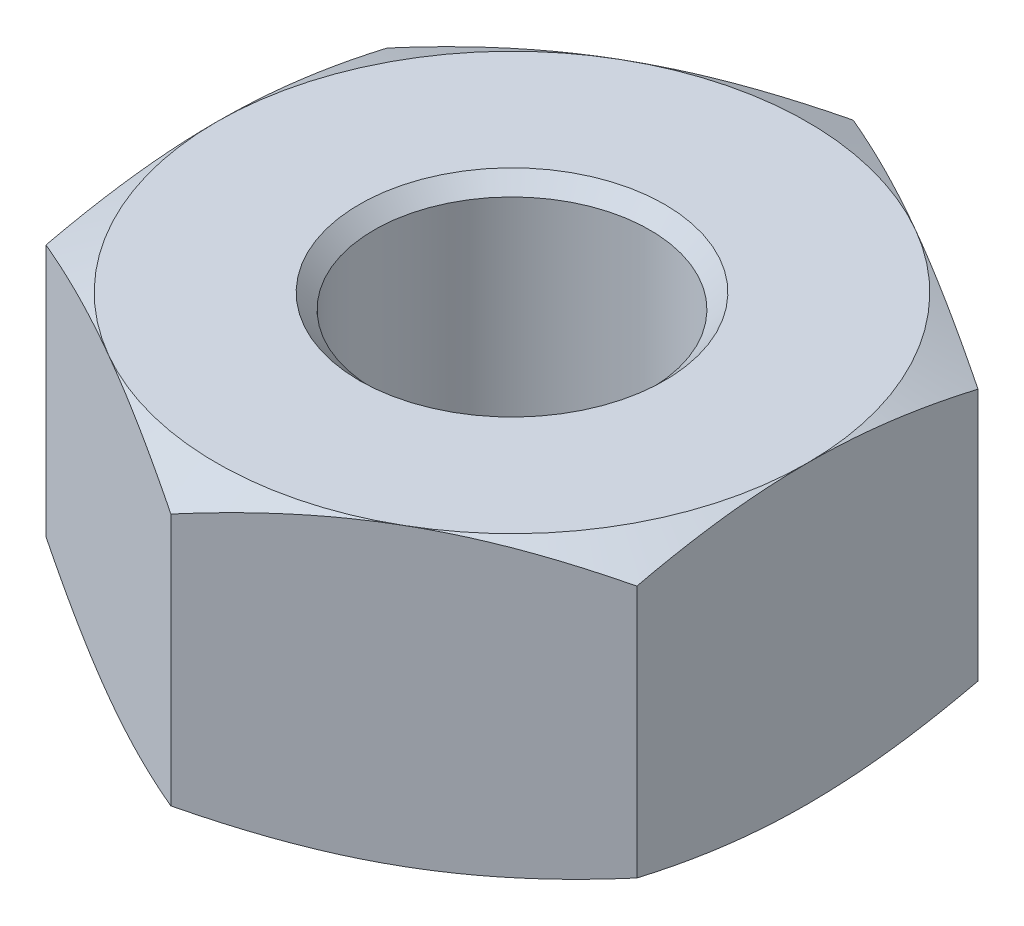
from build123d import *

# Parameters (mm, degrees)
SKETCH1_R           = 1.4
BOSS_EXTRUDE1_DEPTH = 1.5
CHAMFER1_SIZE       = 0.15


with BuildPart() as part:
    # Sketch1 → Boss-Extrude1 (new, symmetric)
    with BuildSketch(Plane(origin=(0, 0, 0), x_dir=(1, 0, 0), z_dir=(0, 1, 0))):
        Polygon((0, 3.464101615), (-3, 1.732050808), (-3, -1.732050808), (0, -3.464101615), (3, -1.732050808), (3, 1.732050808), align=None)
        with Locations(Location((0, 0, 0), (0, 0, 270))):
            Circle(SKETCH1_R, mode=Mode.SUBTRACT)
    extrude(amount=BOSS_EXTRUDE1_DEPTH, both=True)

    # Chamfer1
    chamfer1_edges = [part.edges().sort_by_distance(p)[0] for p in [
        (0, -1.5, -1.4),
        (0, 1.5, -1.4),
    ]]
    chamfer(chamfer1_edges, length=CHAMFER1_SIZE)

    # Sketch2 → Cut-Revolve1 (revolve, cut)
    with BuildSketch(Plane.XY):
        Polygon((-3, 1.5), (-5, 0.567384684), (-5, 1.5), align=None)
    cut_revolve1 = revolve(axis=Axis((0, 0, 0), (0, 1, 0)), mode=Mode.SUBTRACT)

    # Mirror1: Cut-Revolve1 across plane
    add(cut_revolve1.mirror(Plane.ZX), mode=Mode.SUBTRACT)


solid = part.part
